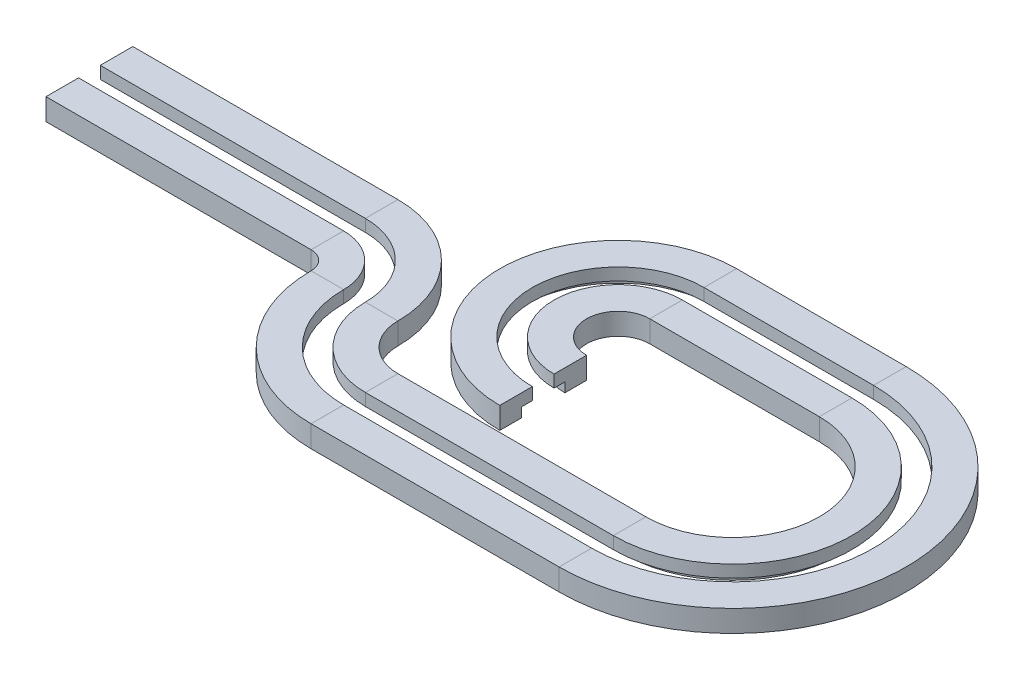
from build123d import *


with BuildPart() as part:
    # Sweep1: sweep along a path in Sketch3
    with BuildLine(Plane(origin=(0, 0, 0), x_dir=(1, 0, 0), z_dir=(0, 1, 0))) as sweep1_path:
        Line((0, 0), (195.402745666, 0))
        ThreePointArc((195.402745666, 0), (227.559166384, -13.319625579), (240.878791962, -45.476046296))
        ThreePointArc((240.878791962, -45.476046296), (260.106014504, -91.894667724), (306.524635932, -111.121890266))
        Line((306.524635932, -111.121890266), (489.339173348, -111.121890266))
        ThreePointArc((489.339173348, -111.121890266), (585.259476302, -15.201587312), (489.339173348, 80.718715642))
        Line((489.339173348, 80.718715642), (364.328124734, 80.718715642))
        ThreePointArc((364.328124734, 80.718715642), (309.043455221, 25.434046129), (364.328124734, -29.850623385))
    # Sketch1 → Sweep1 (sweep)
    with BuildSketch(Plane(origin=(0, 0, 0), x_dir=(0, 0, -1), z_dir=(1, 0, 0))):
        Polygon((16, -16), (32, -16), (32, 0), (8, 0), (8, -9), (16, -9), align=None)
        Polygon((-32, -16), (-16, -16), (-16, -9), (-8, -9), (-8, 0), (-32, 0), align=None)
    sweep(path=sweep1_path.line)


solid = part.part
